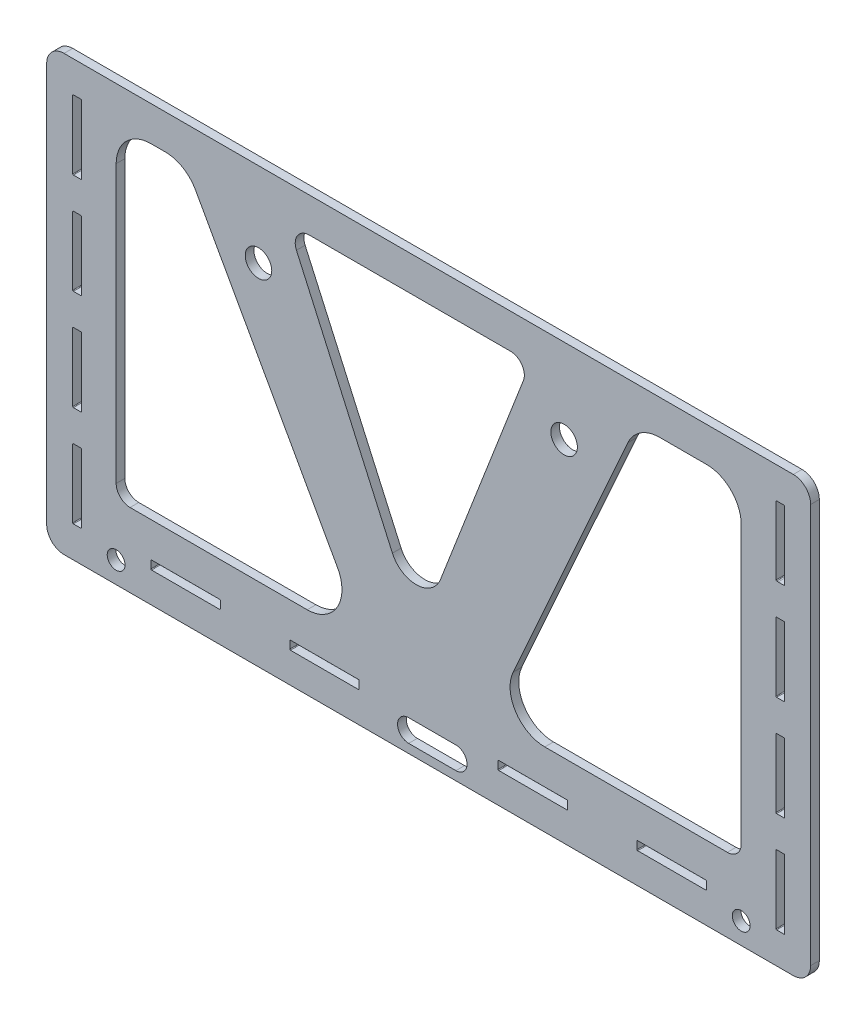
from build123d import *

# Parameters (mm, degrees)
MODEL_R             = 3.2639
MODEL_R_2           = 4.8514
BOSS_EXTRUDE1_DEPTH = 3.175


with BuildPart() as part:
    # Model → Boss-Extrude1 (new body)
    with BuildSketch(Plane.XY):
        with BuildLine():
            Line((531.533981051, 378.581969782), (264.833981051, 378.581969782))
            ThreePointArc((264.833981051, 378.581969782), (260.343852991, 376.722097842), (258.483981051, 372.231969782))
            Line((258.483981051, 372.231969782), (258.483981051, 226.181969782))
            ThreePointArc((258.483981051, 226.181969782), (260.343852991, 221.691841721), (264.833981051, 219.831969782))
            Line((264.833981051, 219.831969782), (531.533981051, 219.831969782))
            ThreePointArc((531.533981051, 219.831969782), (536.024109112, 221.691841721), (537.883981051, 226.181969782))
            Line((537.883981051, 226.181969782), (537.883981051, 372.231969782))
            ThreePointArc((537.883981051, 372.231969782), (536.024109112, 376.722097842), (531.533981051, 378.581969782))
        make_face()
        with Locations((512.483981051, 227.680569782)):
            Circle(MODEL_R, mode=Mode.SUBTRACT)
        with Locations((283.883981051, 227.680569782)):
            Circle(MODEL_R, mode=Mode.SUBTRACT)
        with Locations((335.953981051, 347.727319782)):
            Circle(MODEL_R_2, mode=Mode.SUBTRACT)
        with Locations((447.713981051, 347.727319782)):
            Circle(MODEL_R_2, mode=Mode.SUBTRACT)
        with BuildLine():
            Line((402.498664887, 280.793585302), (432.837061049, 358.963963597))
            ThreePointArc((432.837061049, 358.963963597), (432.293091457, 363.671580259), (428.101226036, 365.881969782))
            Line((428.101226036, 365.881969782), (354.462987986, 365.881969782))
            ThreePointArc((354.462987986, 365.881969782), (350.199561274, 363.564141512), (349.826642813, 358.725746424))
            Line((349.826642813, 358.725746424), (384.925827038, 280.346928102))
            ThreePointArc((384.925827038, 280.346928102), (393.860997539, 274.717922213), (402.498664887, 280.793585302))
        make_face(mode=Mode.SUBTRACT)
        with BuildLine():
            Line((271.196681051, 342.005969782), (271.196681051, 366.897969782))
            ThreePointArc((271.196681051, 366.897969782), (271.122286174, 367.077574904), (270.942681051, 367.151969782))
            Line((270.942681051, 367.151969782), (268.262981051, 367.151969782))
            ThreePointArc((268.262981051, 367.151969782), (268.083375929, 367.077574904), (268.008981051, 366.897969782))
            Line((268.008981051, 366.897969782), (268.008981051, 342.005969782))
            ThreePointArc((268.008981051, 342.005969782), (268.083375929, 341.826364659), (268.262981051, 341.751969782))
            Line((268.262981051, 341.751969782), (270.942681051, 341.751969782))
            ThreePointArc((270.942681051, 341.751969782), (271.122286174, 341.826364659), (271.196681051, 342.005969782))
        make_face(mode=Mode.SUBTRACT)
        with BuildLine():
            Line((271.196681051, 305.175969782), (271.196681051, 330.067969782))
            ThreePointArc((271.196681051, 330.067969782), (271.122286174, 330.247574904), (270.942681051, 330.321969782))
            Line((270.942681051, 330.321969782), (268.262981051, 330.321969782))
            ThreePointArc((268.262981051, 330.321969782), (268.083375929, 330.247574904), (268.008981051, 330.067969782))
            Line((268.008981051, 330.067969782), (268.008981051, 305.175969782))
            ThreePointArc((268.008981051, 305.175969782), (268.083375929, 304.996364659), (268.262981051, 304.921969782))
            Line((268.262981051, 304.921969782), (270.942681051, 304.921969782))
            ThreePointArc((270.942681051, 304.921969782), (271.122286174, 304.996364659), (271.196681051, 305.175969782))
        make_face(mode=Mode.SUBTRACT)
        with BuildLine():
            Line((271.196681051, 268.345969782), (271.196681051, 293.237969782))
            ThreePointArc((271.196681051, 293.237969782), (271.122286174, 293.417574904), (270.942681051, 293.491969782))
            Line((270.942681051, 293.491969782), (268.262981051, 293.491969782))
            ThreePointArc((268.262981051, 293.491969782), (268.083375929, 293.417574904), (268.008981051, 293.237969782))
            Line((268.008981051, 293.237969782), (268.008981051, 268.345969782))
            ThreePointArc((268.008981051, 268.345969782), (268.083375929, 268.166364659), (268.262981051, 268.091969782))
            Line((268.262981051, 268.091969782), (270.942681051, 268.091969782))
            ThreePointArc((270.942681051, 268.091969782), (271.122286174, 268.166364659), (271.196681051, 268.345969782))
        make_face(mode=Mode.SUBTRACT)
        with BuildLine():
            Line((271.196681051, 231.515969782), (271.196681051, 256.407969782))
            ThreePointArc((271.196681051, 256.407969782), (271.122286174, 256.587574904), (270.942681051, 256.661969782))
            Line((270.942681051, 256.661969782), (268.262981051, 256.661969782))
            ThreePointArc((268.262981051, 256.661969782), (268.083375929, 256.587574904), (268.008981051, 256.407969782))
            Line((268.008981051, 256.407969782), (268.008981051, 231.515969782))
            ThreePointArc((268.008981051, 231.515969782), (268.083375929, 231.336364659), (268.262981051, 231.261969782))
            Line((268.262981051, 231.261969782), (270.942681051, 231.261969782))
            ThreePointArc((270.942681051, 231.261969782), (271.122286174, 231.336364659), (271.196681051, 231.515969782))
        make_face(mode=Mode.SUBTRACT)
        with BuildLine():
            Line((283.896681051, 251.912169782), (283.896681051, 353.181969782))
            ThreePointArc((283.896681051, 353.181969782), (287.61642493, 362.162225903), (296.596681051, 365.881969782))
            Line((296.596681051, 365.881969782), (301.818535601, 365.881969782))
            ThreePointArc((301.818535601, 365.881969782), (308.262528638, 364.125687328), (312.924242636, 359.342592417))
            Line((312.924242636, 359.342592417), (364.874206365, 265.692792417))
            ThreePointArc((364.874206365, 265.692792417), (364.712216877, 253.088176744), (353.76849933, 246.832169782))
            Line((353.76849933, 246.832169782), (288.976681051, 246.832169782))
            ThreePointArc((288.976681051, 246.832169782), (285.384578603, 248.320067333), (283.896681051, 251.912169782))
        make_face(mode=Mode.SUBTRACT)
        with BuildLine():
            Line((525.996781051, 341.751969782), (525.450681051, 341.751969782))
            ThreePointArc((525.450681051, 341.751969782), (525.271075929, 341.826364659), (525.196681051, 342.005969782))
            Line((525.196681051, 342.005969782), (525.196681051, 366.897969782))
            ThreePointArc((525.196681051, 366.897969782), (525.271075929, 367.077574904), (525.450681051, 367.151969782))
            Line((525.450681051, 367.151969782), (528.130381051, 367.151969782))
            ThreePointArc((528.130381051, 367.151969782), (528.309986174, 367.077574904), (528.384381051, 366.897969782))
            Line((528.384381051, 366.897969782), (528.384381051, 341.992806539))
            ThreePointArc((528.384381051, 341.992806539), (528.309431086, 341.812648039), (528.128813452, 341.738811376))
            Line((528.128813452, 341.738811376), (525.996781051, 341.751969782))
        make_face(mode=Mode.SUBTRACT)
        with BuildLine():
            Line((296.837981051, 234.132169782), (321.729981051, 234.132169782))
            ThreePointArc((321.729981051, 234.132169782), (321.909586174, 234.057774904), (321.983981051, 233.878169782))
            Line((321.983981051, 233.878169782), (321.983981051, 231.198469782))
            ThreePointArc((321.983981051, 231.198469782), (321.909586174, 231.018864659), (321.729981051, 230.944469782))
            Line((321.729981051, 230.944469782), (296.837981051, 230.944469782))
            ThreePointArc((296.837981051, 230.944469782), (296.658375929, 231.018864659), (296.583981051, 231.198469782))
            Line((296.583981051, 231.198469782), (296.583981051, 233.878169782))
            ThreePointArc((296.583981051, 233.878169782), (296.658375929, 234.057774904), (296.837981051, 234.132169782))
        make_face(mode=Mode.SUBTRACT)
        with BuildLine():
            Line((474.637981051, 234.132169782), (499.529981051, 234.132169782))
            ThreePointArc((499.529981051, 234.132169782), (499.709586174, 234.057774904), (499.783981051, 233.878169782))
            Line((499.783981051, 233.878169782), (499.783981051, 231.198469782))
            ThreePointArc((499.783981051, 231.198469782), (499.709586174, 231.018864659), (499.529981051, 230.944469782))
            Line((499.529981051, 230.944469782), (474.637981051, 230.944469782))
            ThreePointArc((474.637981051, 230.944469782), (474.458375929, 231.018864659), (474.383981051, 231.198469782))
            Line((474.383981051, 231.198469782), (474.383981051, 233.878169782))
            ThreePointArc((474.383981051, 233.878169782), (474.458375929, 234.057774904), (474.637981051, 234.132169782))
        make_face(mode=Mode.SUBTRACT)
        with BuildLine():
            Line((525.196681051, 268.345969782), (525.196681051, 293.237969782))
            ThreePointArc((525.196681051, 293.237969782), (525.271075929, 293.417574904), (525.450681051, 293.491969782))
            Line((525.450681051, 293.491969782), (528.130381051, 293.491969782))
            ThreePointArc((528.130381051, 293.491969782), (528.309986174, 293.417574904), (528.384381051, 293.237969782))
            Line((528.384381051, 293.237969782), (528.384381051, 268.345969782))
            ThreePointArc((528.384381051, 268.345969782), (528.309986174, 268.166364659), (528.130381051, 268.091969782))
            Line((528.130381051, 268.091969782), (525.450681051, 268.091969782))
            ThreePointArc((525.450681051, 268.091969782), (525.271075929, 268.166364659), (525.196681051, 268.345969782))
        make_face(mode=Mode.SUBTRACT)
        with BuildLine():
            Line((525.196681051, 231.515969782), (525.196681051, 256.407969782))
            ThreePointArc((525.196681051, 256.407969782), (525.271075929, 256.587574904), (525.450681051, 256.661969782))
            Line((525.450681051, 256.661969782), (528.130381051, 256.661969782))
            ThreePointArc((528.130381051, 256.661969782), (528.309986174, 256.587574904), (528.384381051, 256.407969782))
            Line((528.384381051, 256.407969782), (528.384381051, 231.515969782))
            ThreePointArc((528.384381051, 231.515969782), (528.309986174, 231.336364659), (528.130381051, 231.261969782))
            Line((528.130381051, 231.261969782), (525.450681051, 231.261969782))
            ThreePointArc((525.450681051, 231.261969782), (525.271075929, 231.336364659), (525.196681051, 231.515969782))
        make_face(mode=Mode.SUBTRACT)
        with BuildLine():
            Line((423.837981051, 234.132169782), (448.729981051, 234.132169782))
            ThreePointArc((448.729981051, 234.132169782), (448.909586174, 234.057774904), (448.983981051, 233.878169782))
            Line((448.983981051, 233.878169782), (448.983981051, 231.198469782))
            ThreePointArc((448.983981051, 231.198469782), (448.909586174, 231.018864659), (448.729981051, 230.944469782))
            Line((448.729981051, 230.944469782), (423.837981051, 230.944469782))
            ThreePointArc((423.837981051, 230.944469782), (423.658375929, 231.018864659), (423.583981051, 231.198469782))
            Line((423.583981051, 231.198469782), (423.583981051, 233.878169782))
            ThreePointArc((423.583981051, 233.878169782), (423.658375929, 234.057774904), (423.837981051, 234.132169782))
        make_face(mode=Mode.SUBTRACT)
        with BuildLine():
            Line((372.783981051, 233.878169782), (372.783981051, 231.198469782))
            ThreePointArc((372.783981051, 231.198469782), (372.709586174, 231.018864659), (372.529981051, 230.944469782))
            Line((372.529981051, 230.944469782), (347.637981051, 230.944469782))
            ThreePointArc((347.637981051, 230.944469782), (347.458375929, 231.018864659), (347.383981051, 231.198469782))
            Line((347.383981051, 231.198469782), (347.383981051, 233.878169782))
            ThreePointArc((347.383981051, 233.878169782), (347.458375929, 234.057774904), (347.637981051, 234.132169782))
            Line((347.637981051, 234.132169782), (372.529981051, 234.132169782))
            ThreePointArc((372.529981051, 234.132169782), (372.709586174, 234.057774904), (372.783981051, 233.878169782))
        make_face(mode=Mode.SUBTRACT)
        with BuildLine():
            Line((525.196681051, 305.175969782), (525.196681051, 330.067969782))
            ThreePointArc((525.196681051, 330.067969782), (525.271075929, 330.247574904), (525.450681051, 330.321969782))
            Line((525.450681051, 330.321969782), (528.130381051, 330.321969782))
            ThreePointArc((528.130381051, 330.321969782), (528.309986174, 330.247574904), (528.384381051, 330.067969782))
            Line((528.384381051, 330.067969782), (528.384381051, 305.175969782))
            ThreePointArc((528.384381051, 305.175969782), (528.309986174, 304.996364659), (528.130381051, 304.921969782))
            Line((528.130381051, 304.921969782), (525.450681051, 304.921969782))
            ThreePointArc((525.450681051, 304.921969782), (525.271075929, 304.996364659), (525.196681051, 305.175969782))
        make_face(mode=Mode.SUBTRACT)
        with BuildLine():
            Line((507.416681051, 246.832169782), (440.663369429, 246.832169782))
            ThreePointArc((440.663369429, 246.832169782), (430.00413229, 252.627775268), (429.073514559, 264.724978663))
            Line((429.073514559, 264.724978663), (471.033100648, 358.374778663))
            ThreePointArc((471.033100648, 358.374778663), (475.718561005, 363.841206921), (482.622955519, 365.881969782))
            Line((482.622955519, 365.881969782), (499.796681051, 365.881969782))
            ThreePointArc((499.796681051, 365.881969782), (508.776937172, 362.162225903), (512.496681051, 353.181969782))
            Line((512.496681051, 353.181969782), (512.496681051, 251.912169782))
            ThreePointArc((512.496681051, 251.912169782), (511.0087835, 248.320067333), (507.416681051, 246.832169782))
        make_face(mode=Mode.SUBTRACT)
        with BuildLine():
            Line((390.878572632, 231.198469782), (408.150572632, 231.198469782))
            ThreePointArc((408.150572632, 231.198469782), (412.214572632, 227.134469782), (408.150572632, 223.070469782))
            Line((408.150572632, 223.070469782), (390.878572632, 223.070469782))
            ThreePointArc((390.878572632, 223.070469782), (386.814572632, 227.134469782), (390.878572632, 231.198469782))
        make_face(mode=Mode.SUBTRACT)
    extrude(amount=BOSS_EXTRUDE1_DEPTH)


solid = part.part
